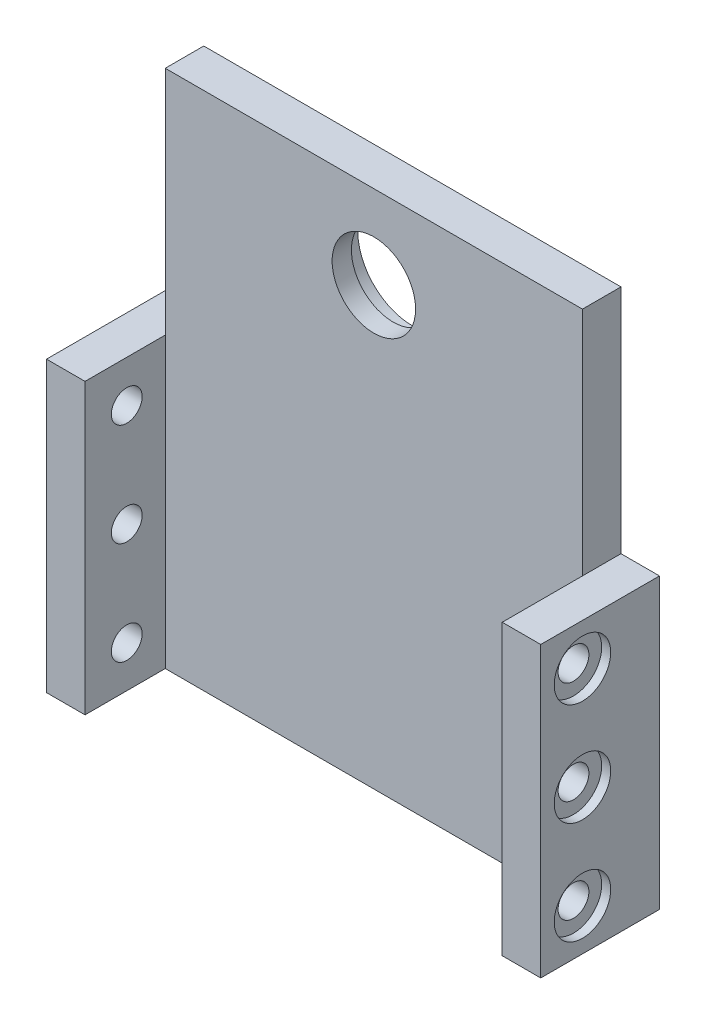
from build123d import *

# Parameters (mm, degrees)
ESBO_O1_W                                            = 32.5
ESBO_O1_H                                            = 40.5
RESSALTO_EXTRUS_O1_DEPTH                             = 3
ESBO_O4_W                                            = 9.25
ESBO_O4_H                                            = 22.5
RESSALTO_EXTRUS_O2_DEPTH                             = 3
ESBO_O5_R                                            = 4.25
CORTE_EXTRUS_O1_DEPTH                                = 1.5
ESBO_O6_R                                            = 3.25
CORTE_EXTRUS_O2_DEPTH                                = 37.217226564
REBAIXO_PARA_PARAFUSO_COM_CABE_A_REDONDA_D           = 2.4
REBAIXO_PARA_PARAFUSO_COM_CABE_A_REDONDA_DEPTH       = 3
REBAIXO_PARA_PARAFUSO_COM_CABE_A_REDONDA_CBORE_D     = 4.4
REBAIXO_PARA_PARAFUSO_COM_CABE_A_REDONDA_CBORE_DEPTH = 0.7


with BuildPart() as part:
    # Esboço1 → Ressalto-extrusão1 (new body)
    with BuildSketch(Plane.XY):
        with Locations((0, 9)):
            Rectangle(ESBO_O1_W, ESBO_O1_H)
    extrude(amount=-RESSALTO_EXTRUS_O1_DEPTH)

    # Esboço4 → Ressalto-extrusão2 (add)
    with BuildSketch(Plane.ZY.offset(16.25)):
        with Locations((1.625, 0)):
            Rectangle(ESBO_O4_W, ESBO_O4_H)
    ressalto_extrus_o2 = extrude(amount=RESSALTO_EXTRUS_O2_DEPTH)

    # Espelhar1: Ressalto-extrusão2 across plane
    add(ressalto_extrus_o2.mirror(Plane(origin=(0, 0, 0), x_dir=(0, 0, 1), z_dir=(1, 0, 0))))

    # Esboço5 → Corte-extrusão1 (cut)
    with BuildSketch(Plane(origin=(0, 0, -3), x_dir=(-1, 0, 0), z_dir=(0, 0, -1))):
        with Locations((0, 22.75)):
            Circle(ESBO_O5_R)
    extrude(amount=-CORTE_EXTRUS_O1_DEPTH, mode=Mode.SUBTRACT)

    # Esboço6 → Corte-extrusão2 (cut, through all)
    with BuildSketch(Plane(origin=(0, 0, -3), x_dir=(-1, 0, 0), z_dir=(0, 0, -1))):
        with Locations(Location((0, 22.75, 0), (0, 0, 180))):
            Circle(ESBO_O6_R)
    extrude(amount=-CORTE_EXTRUS_O2_DEPTH, mode=Mode.SUBTRACT)

    # Rebaixo para parafuso com cabeça redonda de M21
    with Locations(Plane.ZY.offset(19.25)):
        with Locations((3, 8), (3, 0), (3, -8)):
            rebaixo_para_parafuso_com_cabe_a_redonda = CounterBoreHole(REBAIXO_PARA_PARAFUSO_COM_CABE_A_REDONDA_D / 2, REBAIXO_PARA_PARAFUSO_COM_CABE_A_REDONDA_CBORE_D / 2, REBAIXO_PARA_PARAFUSO_COM_CABE_A_REDONDA_CBORE_DEPTH, depth=REBAIXO_PARA_PARAFUSO_COM_CABE_A_REDONDA_DEPTH)

    # Espelhar3: Rebaixo para parafuso com cabeça redonda de M21 across plane
    add(rebaixo_para_parafuso_com_cabe_a_redonda.mirror(Plane(origin=(0, 0, 0), x_dir=(0, 0, 1), z_dir=(1, 0, 0))), mode=Mode.SUBTRACT)


solid = part.part
